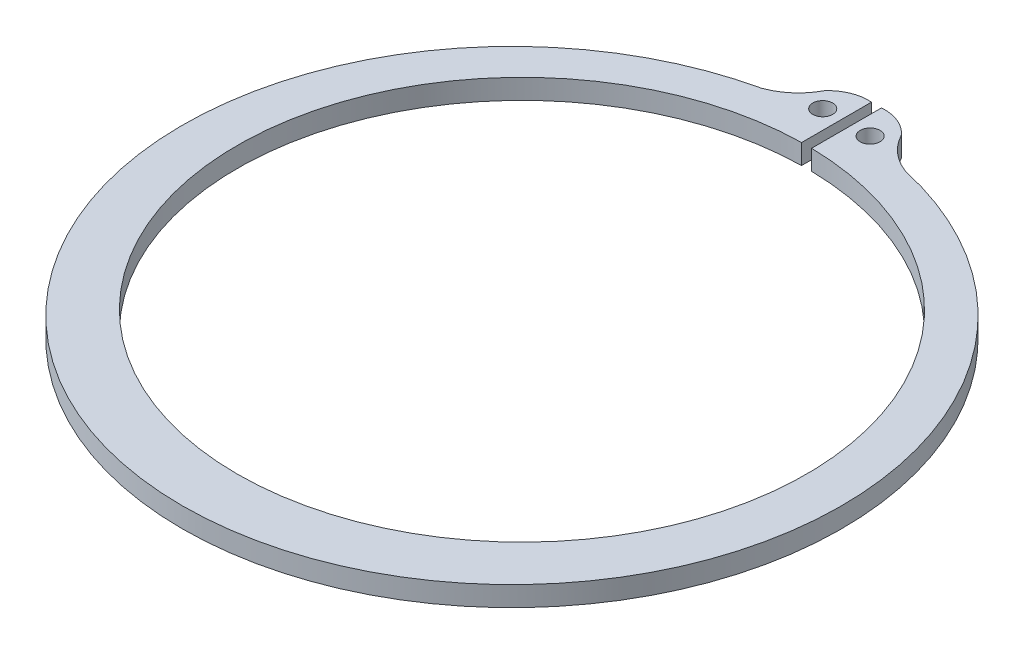
from build123d import *

# Parameters (mm, degrees)
RESSALTO_EXTRUS_O1_DEPTH = 2
ESBO_O2_R                = 0.995647449
CORTE_EXTRUS_O1_DEPTH    = 2


with BuildPart() as part:
    # Esboço1 → Ressalto-extrusão1 (new body)
    with BuildSketch(Plane(origin=(0, 0, 0), x_dir=(1, 0, 0), z_dir=(0, 1, 0))):
        with BuildLine():
            Line((-0.5, 35.495613698), (-0.5, 28.495613698))
            ThreePointArc((-0.5, 28.495613698), (0, -28.5), (0.5, 28.495613698))
            Line((0.5, 28.495613698), (0.5, 35.495613698))
            ThreePointArc((0.5, 35.495613698), (2.33575042, 35.209276303), (3.8486175, 34.130757919))
            ThreePointArc((3.8486175, 34.130757919), (5.24059873, 32.366531639), (7.168579512, 31.211977086))
            ThreePointArc((7.168579512, 31.211977086), (0, -34), (-7.168579512, 31.211977086))
            ThreePointArc((-7.168579512, 31.211977086), (-5.24059873, 32.366531639), (-3.8486175, 34.130757919))
            ThreePointArc((-3.8486175, 34.130757919), (-2.33575042, 35.209276303), (-0.5, 35.495613698))
        make_face()
    extrude(amount=RESSALTO_EXTRUS_O1_DEPTH)

    # Esboço2 → Corte-extrusão1 (cut)
    with BuildSketch(Plane(origin=(0, 2, 0), x_dir=(1, 0, 0), z_dir=(0, 1, 0))):
        with Locations(Location((-2.373103124, 32.484243676, 0), (0, 0, 270))):
            Circle(ESBO_O2_R)
        with Locations(Location((2.373103124, 32.484243676, 0), (0, 0, 90))):
            Circle(ESBO_O2_R)
    extrude(amount=-CORTE_EXTRUS_O1_DEPTH, mode=Mode.SUBTRACT)


solid = part.part
